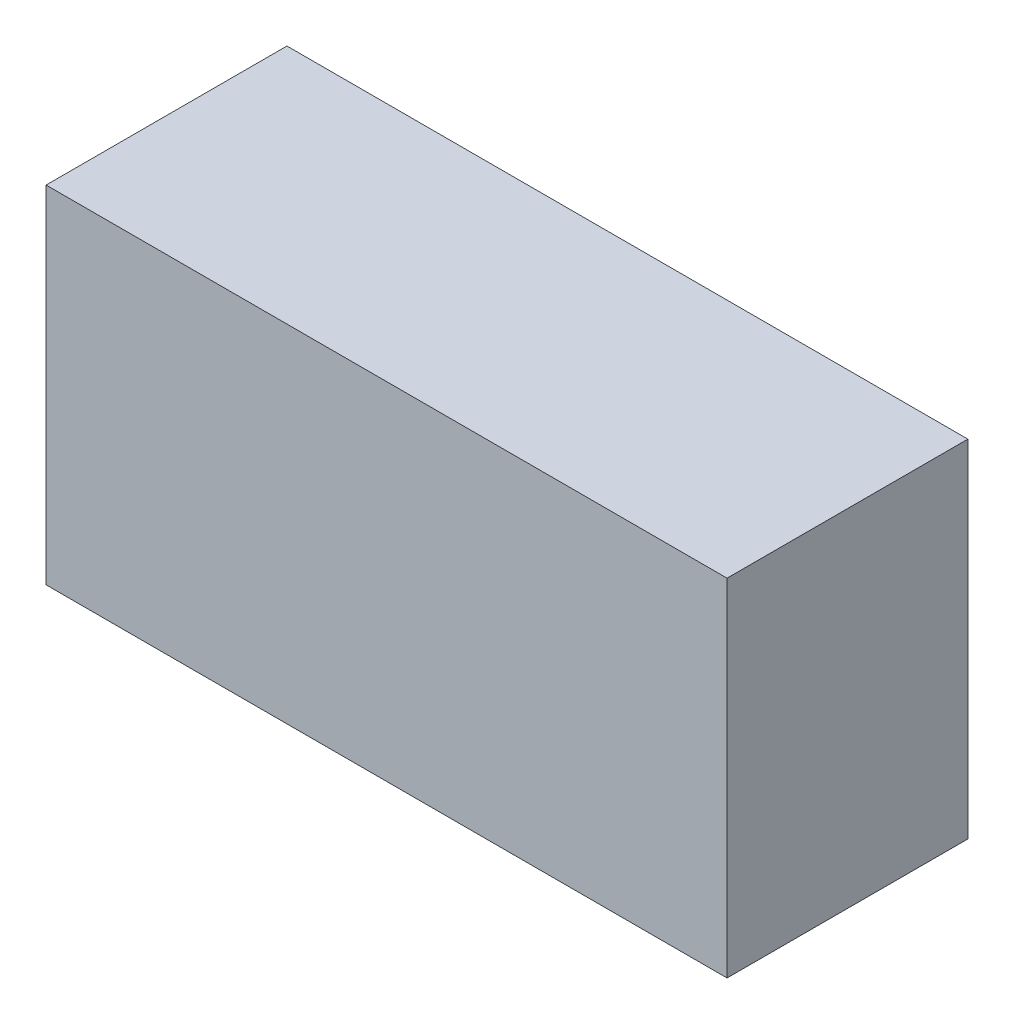
from build123d import *

# Parameters (mm, degrees)
SKETCH1_W           = 82
SKETCH1_H           = 29
BOSS_EXTRUDE1_DEPTH = 41.7


with BuildPart() as part:
    # Sketch1 → Boss-Extrude1 (new body)
    with BuildSketch(Plane(origin=(0, 0, 0), x_dir=(1, 0, 0), z_dir=(0, 1, 0))):
        with Locations((41, 14.5)):
            Rectangle(SKETCH1_W, SKETCH1_H)
    extrude(amount=BOSS_EXTRUDE1_DEPTH)


solid = part.part
